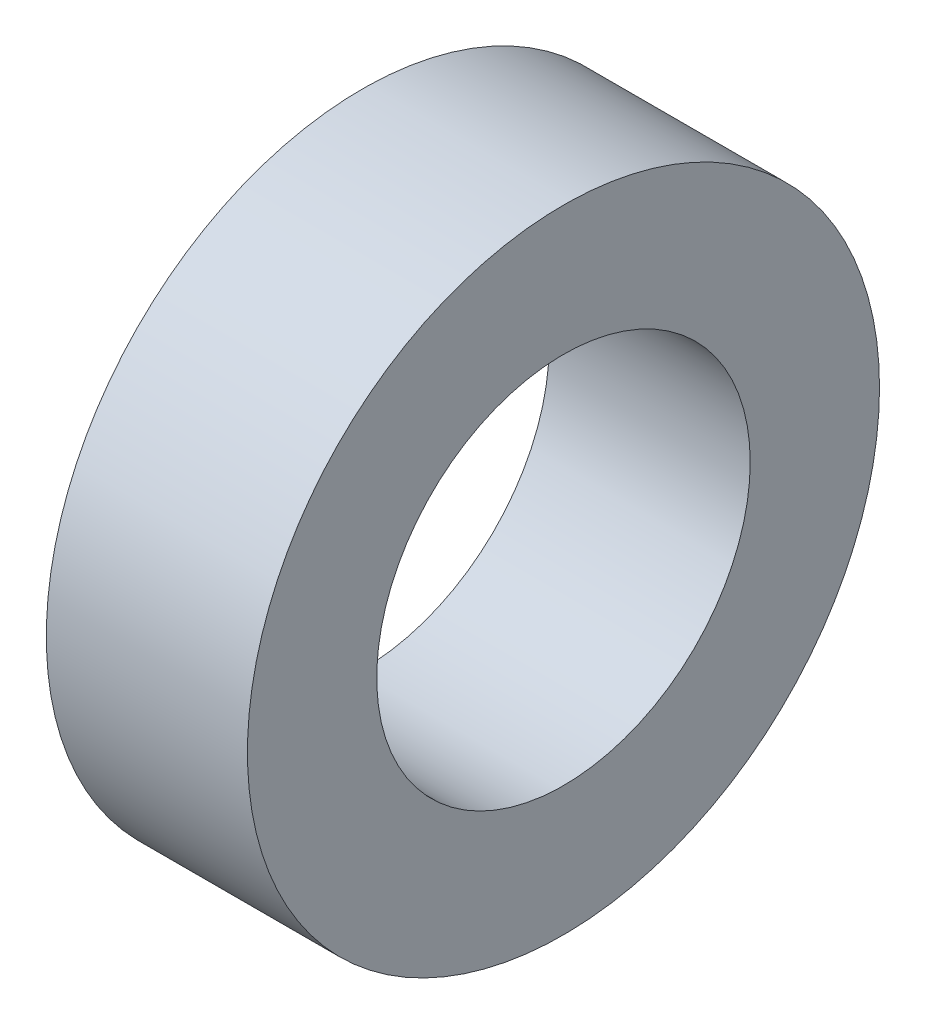
from build123d import *

# Parameters (mm, degrees)
SKETCH_1_R      = 11
SKETCH_1_R_2    = 6.5
EXTRUDE_1_DEPTH = 7


with BuildPart() as part:
    # 草图1 → 凸台-拉伸1 (new body)
    with BuildSketch(Plane(origin=(0, 0, 0), x_dir=(0, 0, -1), z_dir=(1, 0, 0))):
        Circle(SKETCH_1_R)
        Circle(SKETCH_1_R_2, mode=Mode.SUBTRACT)
    extrude(amount=EXTRUDE_1_DEPTH)


solid = part.part
